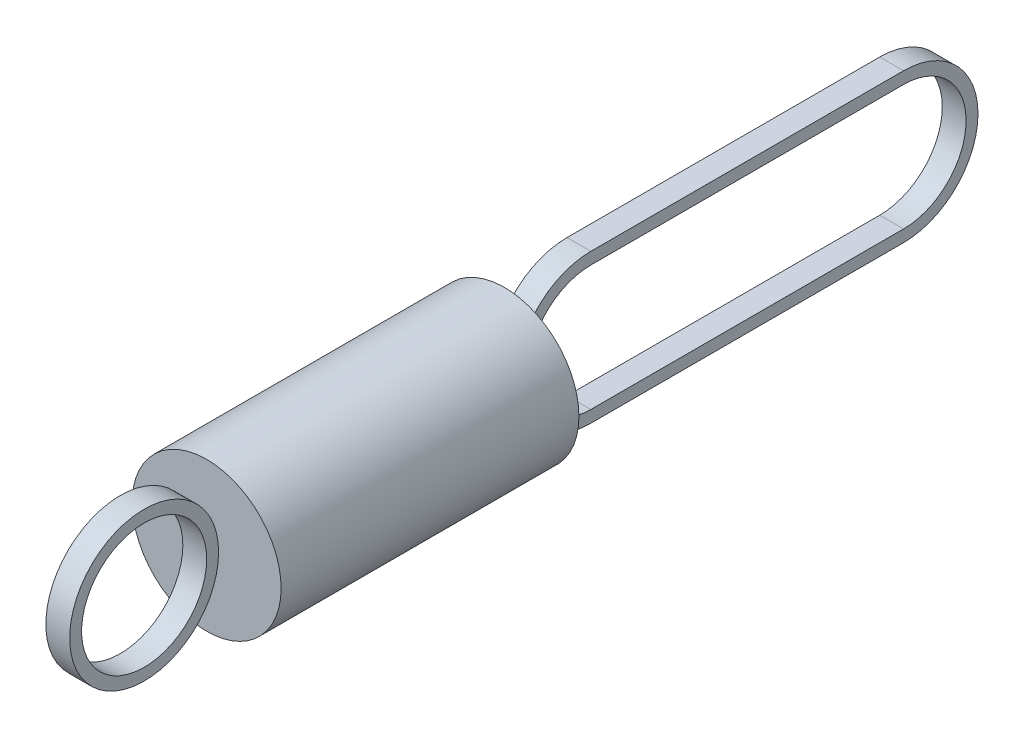
from build123d import *

# Parameters (mm, degrees)
BOSS_EXTRUDE1_DEPTH        = 0.8
BOSS_EXTRUDE1_DEPTH_BACK   = 0.8
SKETCH1_R                  = 5
BOSS_EXTRUDE1_2_DEPTH      = 0.8
BOSS_EXTRUDE1_2_DEPTH_BACK = 0.8
SKETCH2_R                  = 4.2
CUT_EXTRUDE1_DEPTH         = 1.6
SKETCH6_R                  = 5
BOSS_EXTRUDE3_DEPTH        = 20


with BuildPart() as part:
    # Sketch1 → Boss-Extrude1 (new, two sides: drawn at the far end of the back side and taken through both)
    with BuildSketch(Plane(origin=(0, 0, 0), x_dir=(0, 0, -1), z_dir=(1, 0, 0)).offset(-BOSS_EXTRUDE1_DEPTH_BACK)):
        Circle(SKETCH1_R)
    extrude(amount=BOSS_EXTRUDE1_DEPTH + BOSS_EXTRUDE1_DEPTH_BACK)


with BuildPart() as body_2:
    # Sketch1 → Boss-Extrude1 2 (new, two sides: drawn at the far end of the back side and taken through both)
    with BuildSketch(Plane(origin=(0, 0, 0), x_dir=(0, 0, -1), z_dir=(1, 0, 0)).offset(-BOSS_EXTRUDE1_2_DEPTH_BACK)):
        with BuildLine():
            Line((51, -5), (30, -5))
            ThreePointArc((30, -5), (25, 0), (30, 5))
            Line((30, 5), (51, 5))
            ThreePointArc((51, 5), (56, 0), (51, -5))
        make_face()
    extrude(amount=BOSS_EXTRUDE1_2_DEPTH + BOSS_EXTRUDE1_2_DEPTH_BACK)


with BuildPart() as cut_extrude1_tool:
    # Sketch2 → Cut-Extrude1 (new body)
    with BuildSketch(Plane(origin=(0.8, 0, 0), x_dir=(0, 0, -1), z_dir=(1, 0, 0))):
        Circle(SKETCH2_R)
        with BuildLine():
            Line((51, -4.2), (30, -4.2))
            ThreePointArc((30, -4.2), (25.8, 0), (30, 4.2))
            Line((30, 4.2), (51, 4.2))
            ThreePointArc((51, 4.2), (55.2, 0), (51, -4.2))
        make_face()
    extrude(amount=-CUT_EXTRUDE1_DEPTH)


with BuildPart() as part_1:
    add(part.part)

    # Cut-Extrude1: cut by cut_extrude1_tool
    add(cut_extrude1_tool.part, mode=Mode.SUBTRACT)


with BuildPart() as body_2_1:
    add(body_2.part)

    # Cut-Extrude1: cut by cut_extrude1_tool
    add(cut_extrude1_tool.part, mode=Mode.SUBTRACT)


with BuildPart() as body_3:
    # Sketch6 → Boss-Extrude3 (new body)
    with BuildSketch(Plane.XY.offset(-5)):
        Circle(SKETCH6_R)
    extrude(amount=-BOSS_EXTRUDE3_DEPTH)


solid = Compound([part_1.part, body_2_1.part, body_3.part])
